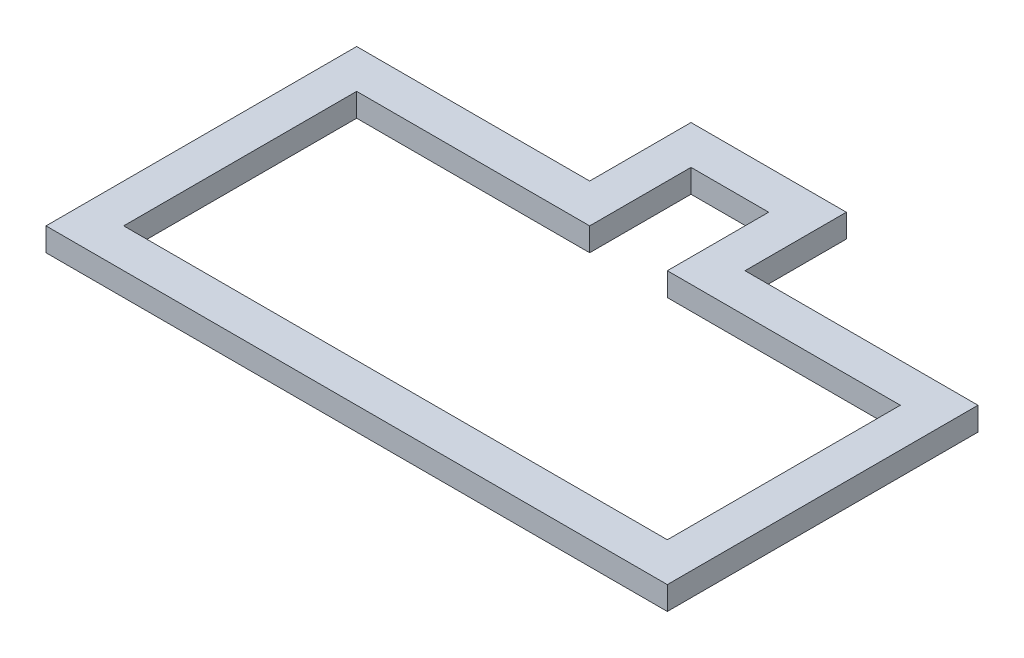
from build123d import *

# Parameters (mm, degrees)
BOSS_EXTRUDE4_DEPTH = 30


with BuildPart() as part:
    # Sketch1 → Boss-Extrude4 (new body)
    with BuildSketch(Plane(origin=(0, 0, 0), x_dir=(1, 0, 0), z_dir=(0, 1, 0))):
        Polygon((-99.811676083, 163.465160075), (-399.811676083, 163.465160075), (-399.811676083, -236.534839925), (400.188323917, -236.534839925), (400.188323917, 163.465160075), (100.188323917, 163.465160075), (50.188323917, 163.465160075), (50.188323917, 113.465160075), (350.188323917, 113.465160075), (350.188323917, -186.534839925), (-349.811676083, -186.534839925), (-349.811676083, 113.465160075), (-49.811676083, 113.465160075), (-49.811676083, 163.465160075), align=None)
        Polygon((-99.811676083, 293.948122897), (-99.811676083, 163.465160075), (-49.811676083, 163.465160075), (-49.811676083, 243.948122897), (50.188323917, 243.948122897), (50.188323917, 163.465160075), (100.188323917, 163.465160075), (100.188323917, 293.948122897), align=None)
    extrude(amount=BOSS_EXTRUDE4_DEPTH)


solid = part.part
